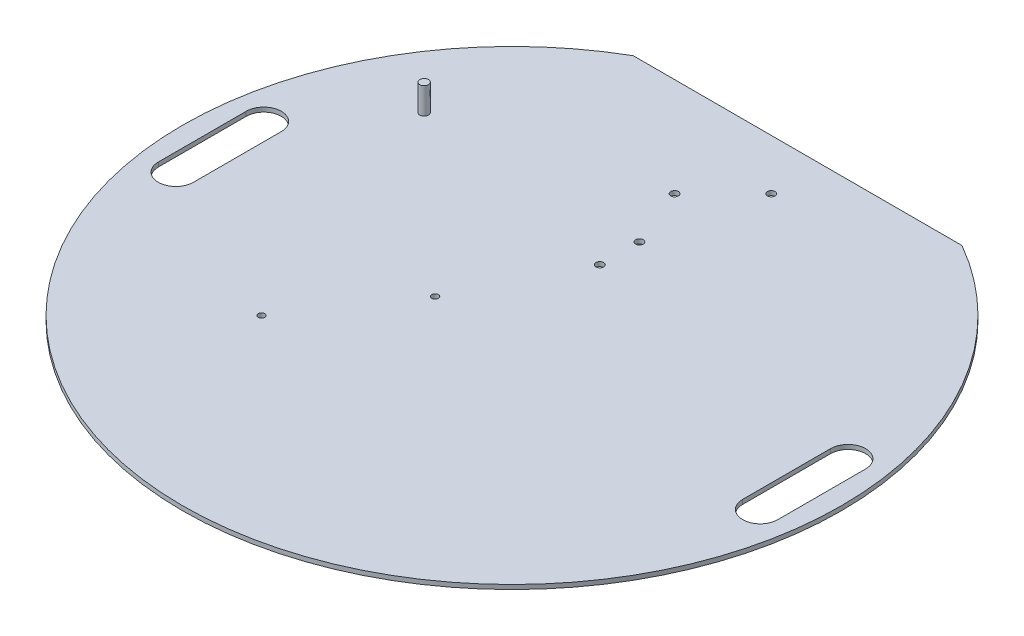
from build123d import *

# Parameters (mm, degrees)
BOSS_EXTRU_1_DEPTH      = 2
ESQUISSE3_R             = 1.5
ESQUISSE3_R_2           = 1.75
ENL_V_MAT_EXTRU_1_DEPTH = 213.141462237
ESQUISSE4_R             = 2
GOUJON_M4X12_DEPTH      = 12


with BuildPart() as part:
    # Esquisse2 → Boss.-Extru.1 (new body)
    with BuildSketch(Plane(origin=(0, 0, 0), x_dir=(1, 0, 0), z_dir=(0, 1, 0))):
        with BuildLine():
            Line((-74.833147735, 130), (74.833147735, 130))
            ThreePointArc((74.833147735, 130), (0, -150), (-74.833147735, 130))
        make_face()
    extrude(amount=BOSS_EXTRU_1_DEPTH)

    # Esquisse3 → Enlèv. mat.-Extru.1 (cut, through all)
    with BuildSketch(Plane(origin=(0, 0, 0), x_dir=(-1, 0, 0), z_dir=(0, -1, 0))):
        with Locations((25, -10)):
            Circle(ESQUISSE3_R)
        with Locations((57, -57)):
            Circle(ESQUISSE3_R)
        with Locations((0, 40)):
            Circle(ESQUISSE3_R_2)
        with Locations((0, 58)):
            Circle(ESQUISSE3_R_2)
        with Locations((-11, 107)):
            Circle(ESQUISSE3_R_2)
        with Locations((11, 85)):
            Circle(ESQUISSE3_R_2)
        with BuildLine():
            Line((125, -20), (125, 20))
            ThreePointArc((125, 20), (133, 28), (141, 20))
            Line((141, 20), (141, -20))
            ThreePointArc((141, -20), (133, -28), (125, -20))
        make_face()
        with BuildLine():
            Line((-141, -20), (-141, 20))
            ThreePointArc((-141, 20), (-133, 28), (-125, 20))
            Line((-125, 20), (-125, -20))
            ThreePointArc((-125, -20), (-133, -28), (-141, -20))
        make_face()
    extrude(amount=-ENL_V_MAT_EXTRU_1_DEPTH, mode=Mode.SUBTRACT)

    # Esquisse4 → Goujon M4x12 (add)
    with BuildSketch(Plane(origin=(0, 2, 0), x_dir=(1, 0, 0), z_dir=(0, 1, 0))):
        with Locations((-100, 60)):
            Circle(ESQUISSE4_R)
    extrude(amount=GOUJON_M4X12_DEPTH)


solid = part.part
